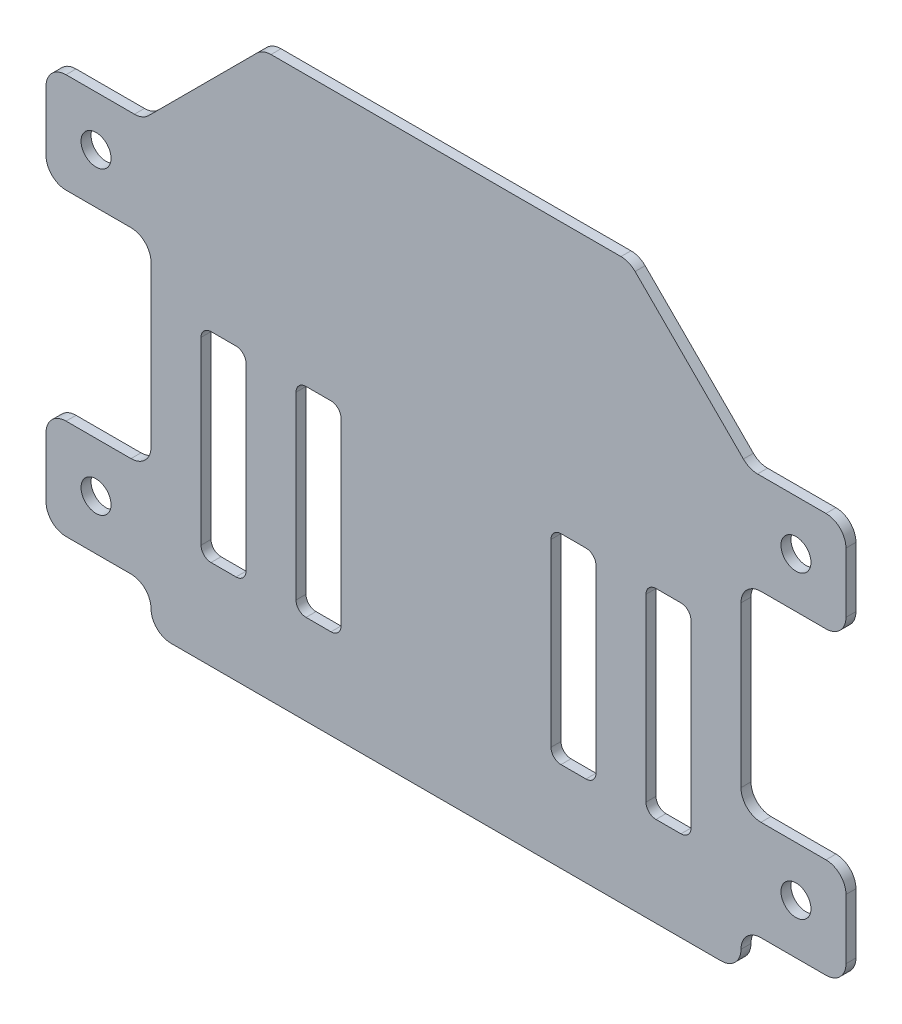
from build123d import *

# Parameters (mm, degrees)
MODEL_R         = 1.5
EXTRUDE_1_DEPTH = 1


with BuildPart() as part:
    # Model → Бобышка-Вытянуть1 (new body)
    with BuildSketch(Plane.XY):
        with BuildLine():
            Line((-29.5, 16), (-29.5, 32))
            ThreePointArc((-29.5, 32), (-30.085786438, 33.414213562), (-31.5, 34))
            Line((-31.5, 34), (-38, 34))
            ThreePointArc((-38, 34), (-39.414213562, 34.585786438), (-40, 36))
            Line((-40, 36), (-40, 42))
            ThreePointArc((-40, 42), (-39.414213562, 43.414213562), (-38, 44))
            Line((-38, 44), (-31.156854249, 44))
            ThreePointArc((-31.156854249, 44), (-30.391487385, 44.152240935), (-29.742640687, 44.585786438))
            Line((-29.742640687, 44.585786438), (-18.914213562, 55.414213562))
            ThreePointArc((-18.914213562, 55.414213562), (-18.265366865, 55.847759065), (-17.5, 56))
            Line((-17.5, 56), (0, 56))
            Line((0, 56), (17.5, 56))
            ThreePointArc((17.5, 56), (18.265366865, 55.847759065), (18.914213562, 55.414213562))
            Line((18.914213562, 55.414213562), (29.742640687, 44.585786438))
            ThreePointArc((29.742640687, 44.585786438), (30.391487385, 44.152240935), (31.156854249, 44))
            Line((31.156854249, 44), (38, 44))
            ThreePointArc((38, 44), (39.414213562, 43.414213562), (40, 42))
            Line((40, 42), (40, 36))
            ThreePointArc((40, 36), (39.414213562, 34.585786438), (38, 34))
            Line((38, 34), (31.5, 34))
            ThreePointArc((31.5, 34), (30.085786438, 33.414213562), (29.5, 32))
            Line((29.5, 32), (29.5, 16))
            ThreePointArc((29.5, 16), (30.085786438, 14.585786438), (31.5, 14))
            Line((31.5, 14), (38, 14))
            ThreePointArc((38, 14), (39.414213562, 13.414213562), (40, 12))
            Line((40, 12), (40, 6))
            ThreePointArc((40, 6), (39.414213562, 4.585786438), (38, 4))
            Line((38, 4), (31.5, 4))
            ThreePointArc((31.5, 4), (30.085786438, 3.414213562), (29.5, 2))
            ThreePointArc((29.5, 2), (28.914213562, 0.585786438), (27.5, 0))
            Line((27.5, 0), (0, 0))
            Line((0, 0), (-27.5, 0))
            ThreePointArc((-27.5, 0), (-28.914213562, 0.585786438), (-29.5, 2))
            ThreePointArc((-29.5, 2), (-30.085786438, 3.414213562), (-31.5, 4))
            Line((-31.5, 4), (-38, 4))
            ThreePointArc((-38, 4), (-39.414213562, 4.585786438), (-40, 6))
            Line((-40, 6), (-40, 12))
            ThreePointArc((-40, 12), (-39.414213562, 13.414213562), (-38, 14))
            Line((-38, 14), (-31.5, 14))
            ThreePointArc((-31.5, 14), (-30.085786438, 14.585786438), (-29.5, 16))
        make_face()
        with Locations((-35, 9)):
            Circle(MODEL_R, mode=Mode.SUBTRACT)
        with Locations((-35, 39)):
            Circle(MODEL_R, mode=Mode.SUBTRACT)
        with Locations((35, 9)):
            Circle(MODEL_R, mode=Mode.SUBTRACT)
        with Locations((35, 39)):
            Circle(MODEL_R, mode=Mode.SUBTRACT)
        with BuildLine():
            Line((-23.5, 9), (-21, 9))
            ThreePointArc((-21, 9), (-20.292893219, 9.292893219), (-20, 10))
            Line((-20, 10), (-20, 28))
            ThreePointArc((-20, 28), (-20.292893219, 28.707106781), (-21, 29))
            Line((-21, 29), (-23.5, 29))
            ThreePointArc((-23.5, 29), (-24.207106781, 28.707106781), (-24.5, 28))
            Line((-24.5, 28), (-24.5, 10))
            ThreePointArc((-24.5, 10), (-24.207106781, 9.292893219), (-23.5, 9))
        make_face(mode=Mode.SUBTRACT)
        with BuildLine():
            Line((-14, 9), (-11.5, 9))
            ThreePointArc((-11.5, 9), (-10.792893219, 9.292893219), (-10.5, 10))
            Line((-10.5, 10), (-10.5, 28))
            ThreePointArc((-10.5, 28), (-10.792893219, 28.707106781), (-11.5, 29))
            Line((-11.5, 29), (-14, 29))
            ThreePointArc((-14, 29), (-14.707106781, 28.707106781), (-15, 28))
            Line((-15, 28), (-15, 10))
            ThreePointArc((-15, 10), (-14.707106781, 9.292893219), (-14, 9))
        make_face(mode=Mode.SUBTRACT)
        with BuildLine():
            Line((23.5, 9), (21, 9))
            ThreePointArc((21, 9), (20.292893219, 9.292893219), (20, 10))
            Line((20, 10), (20, 28))
            ThreePointArc((20, 28), (20.292893219, 28.707106781), (21, 29))
            Line((21, 29), (23.5, 29))
            ThreePointArc((23.5, 29), (24.207106781, 28.707106781), (24.5, 28))
            Line((24.5, 28), (24.5, 10))
            ThreePointArc((24.5, 10), (24.207106781, 9.292893219), (23.5, 9))
        make_face(mode=Mode.SUBTRACT)
        with BuildLine():
            Line((14, 9), (11.5, 9))
            ThreePointArc((11.5, 9), (10.792893219, 9.292893219), (10.5, 10))
            Line((10.5, 10), (10.5, 28))
            ThreePointArc((10.5, 28), (10.792893219, 28.707106781), (11.5, 29))
            Line((11.5, 29), (14, 29))
            ThreePointArc((14, 29), (14.707106781, 28.707106781), (15, 28))
            Line((15, 28), (15, 10))
            ThreePointArc((15, 10), (14.707106781, 9.292893219), (14, 9))
        make_face(mode=Mode.SUBTRACT)
    extrude(amount=EXTRUDE_1_DEPTH)


solid = part.part
